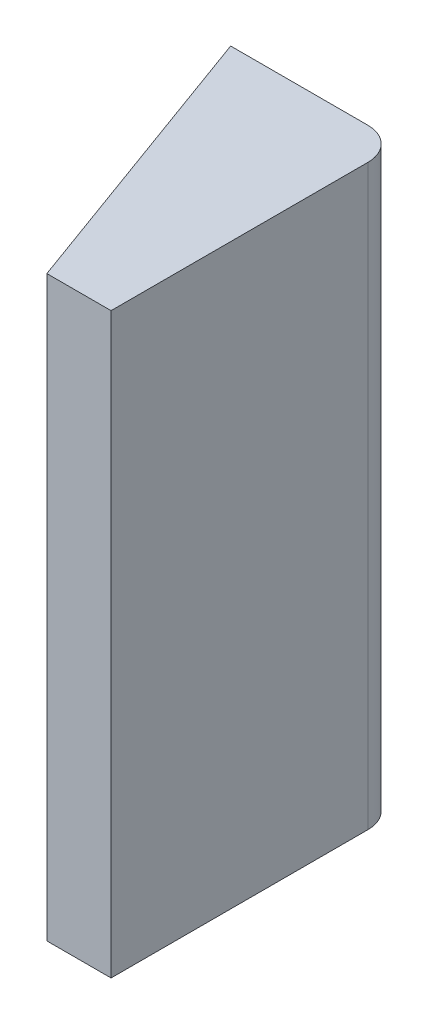
from build123d import *

# Parameters (mm, degrees)
EXTRUDE_1_DEPTH = 90
FILLET_1_R      = 5


with BuildPart() as part:
    # 草图1 → 凸台-拉伸1 (new body)
    with BuildSketch(Plane(origin=(0, 0, 0), x_dir=(1, 0, 0), z_dir=(0, 1, 0))):
        Polygon((0, 0), (16.378660542, -45), (26.378660542, -45), (26.378660542, 0), align=None)
    extrude(amount=EXTRUDE_1_DEPTH)

    # 圆角1
    fillet_1_edges = [part.edges().sort_by_distance(p)[0] for p in [
        (26.378660542, 45, 0),
    ]]
    fillet(fillet_1_edges, radius=FILLET_1_R)


solid = part.part
